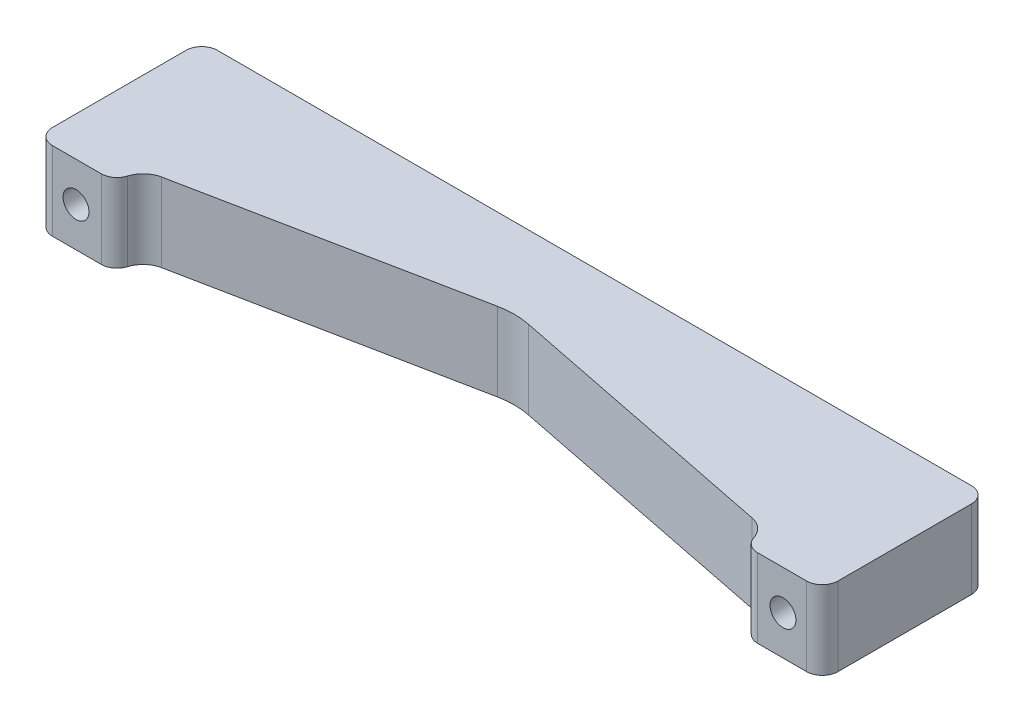
from build123d import *

# Parameters (mm, degrees)
EXTRUDE_1_DEPTH = 10
FILLET_1_R      = 3
FILLET_2_R      = 10
M4X0_71_D       = 3.3
FILLET_3_R      = 2


with BuildPart() as part:
    # Эскиз1 → Бобышка-Вытянуть1 (new body)
    with BuildSketch(Plane(origin=(0, 0, 0), x_dir=(1, 0, 0), z_dir=(0, 1, 0))):
        Polygon((0, 11), (-40, 3), (-40, 0), (-50, 0), (-50, 21), (50, 21), (50, 0), (40, 0), (40, 3), align=None)
    extrude(amount=EXTRUDE_1_DEPTH)

    # Скругление1
    fillet_1_edges = [part.edges().sort_by_distance(p)[0] for p in [
        (-40, 5, -3),
        (40, 5, -3),
    ]]
    fillet(fillet_1_edges, radius=FILLET_1_R)

    # Скругление2
    fillet_2_edges = [part.edges().sort_by_distance(p)[0] for p in [
        (0, 5, -11),
    ]]
    fillet(fillet_2_edges, radius=FILLET_2_R)

    # Отверстие обработанное метчиком M4x0.71 (through all)
    with Locations(Plane.XY):
        with Locations((-45, 5), (45, 5)):
            Hole(M4X0_71_D / 2)

    # Скругление3
    fillet_3_edges = [part.edges().sort_by_distance(p)[0] for p in [
        (40, 5, 0),
        (50, 5, 0),
        (50, 5, -21),
        (-50, 5, -21),
        (-50, 5, 0),
        (-40, 5, 0),
    ]]
    fillet(fillet_3_edges, radius=FILLET_3_R)


solid = part.part
